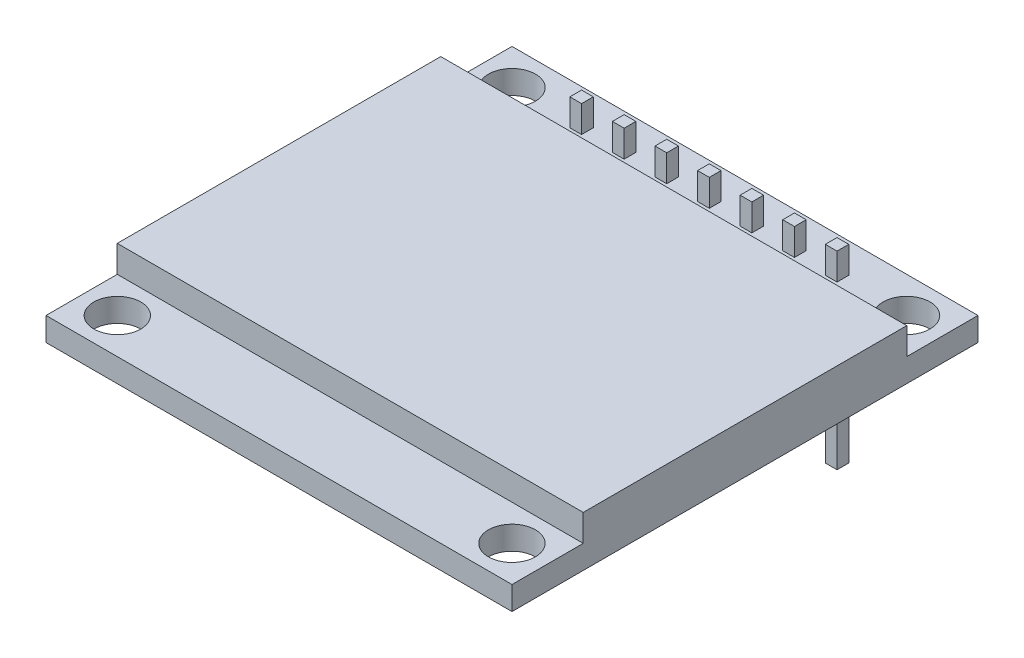
from build123d import *

# Parameters (mm, degrees)
SKETCH_1_W      = 27.8
SKETCH_1_H      = 27.8
SKETCH_1_R      = 1.4
EXTRUDE_1_DEPTH = 1.4
SKETCH_1_3_W    = 27.8
SKETCH_1_3_H    = 19.3
EXTRUDE_2_DEPTH = 3
SKETCH_1_4_W    = 2.54
SKETCH_1_4_H    = 2.54
EXTRUDE_3_DEPTH = 2.54
EXTRUDE_START   = 3
SKETCH_1_5_W    = 0.7
SKETCH_1_5_H    = 0.7
EXTRUDE_4_DEPTH = 11.3


with BuildPart() as part:
    # 草图1 → 凸台-拉伸1 (new body)
    with BuildSketch(Plane(origin=(0, 0, 0), x_dir=(1, 0, 0), z_dir=(0, 1, 0))):
        with Locations((13.9, -13.9)):
            Rectangle(SKETCH_1_W, SKETCH_1_H)
        with Locations(Location((2.13, -2.13, 0), (0, 0, 270))):
            Circle(SKETCH_1_R, mode=Mode.SUBTRACT)
        with Locations(Location((25.67, -2.13, 0), (0, 0, 270))):
            Circle(SKETCH_1_R, mode=Mode.SUBTRACT)
        with Locations(Location((2.13, -25.675, 0), (0, 0, 270))):
            Circle(SKETCH_1_R, mode=Mode.SUBTRACT)
        with Locations(Location((25.67, -25.675, 0), (0, 0, 270))):
            Circle(SKETCH_1_R, mode=Mode.SUBTRACT)
    extrude(amount=EXTRUDE_1_DEPTH)

    # 草图1<3> → 凸台-拉伸2 (add)
    with BuildSketch(Plane(origin=(0, 0, 0), x_dir=(1, 0, 0), z_dir=(0, 1, 0))):
        with Locations((13.9, -13.9)):
            Rectangle(SKETCH_1_3_W, SKETCH_1_3_H)
    extrude(amount=EXTRUDE_2_DEPTH)

    # 草图1<4> → 凸台-拉伸3 (add)
    with BuildSketch(Plane(origin=(0, 0, 0), x_dir=(1, 0, 0), z_dir=(0, 1, 0))):
        with Locations((6.28, -2.13)):
            Rectangle(SKETCH_1_4_W, SKETCH_1_4_H)
        with Locations((8.82, -2.13)):
            Rectangle(SKETCH_1_4_W, SKETCH_1_4_H)
        with Locations((11.36, -2.13)):
            Rectangle(SKETCH_1_4_W, SKETCH_1_4_H)
        with Locations((13.9, -2.13)):
            Rectangle(SKETCH_1_4_W, SKETCH_1_4_H)
        with Locations((16.44, -2.13)):
            Rectangle(SKETCH_1_4_W, SKETCH_1_4_H)
        with Locations((18.98, -2.13)):
            Rectangle(SKETCH_1_4_W, SKETCH_1_4_H)
        with Locations((21.52, -2.13)):
            Rectangle(SKETCH_1_4_W, SKETCH_1_4_H)
    extrude(amount=-EXTRUDE_3_DEPTH)

    # 草图1<5> → 凸台-拉伸4 (add)
    with BuildSketch(Plane(origin=(0, 0, 0), x_dir=(1, 0, 0), z_dir=(0, 1, 0)).offset(EXTRUDE_START)):
        with Locations((6.28, -2.13)):
            Rectangle(SKETCH_1_5_W, SKETCH_1_5_H)
        with Locations((8.82, -2.13)):
            Rectangle(SKETCH_1_5_W, SKETCH_1_5_H)
        with Locations((11.36, -2.13)):
            Rectangle(SKETCH_1_5_W, SKETCH_1_5_H)
        with Locations((13.9, -2.13)):
            Rectangle(SKETCH_1_5_W, SKETCH_1_5_H)
        with Locations((16.44, -2.13)):
            Rectangle(SKETCH_1_5_W, SKETCH_1_5_H)
        with Locations((18.98, -2.13)):
            Rectangle(SKETCH_1_5_W, SKETCH_1_5_H)
        with Locations((21.52, -2.13)):
            Rectangle(SKETCH_1_5_W, SKETCH_1_5_H)
    extrude(amount=-EXTRUDE_4_DEPTH)


solid = part.part
